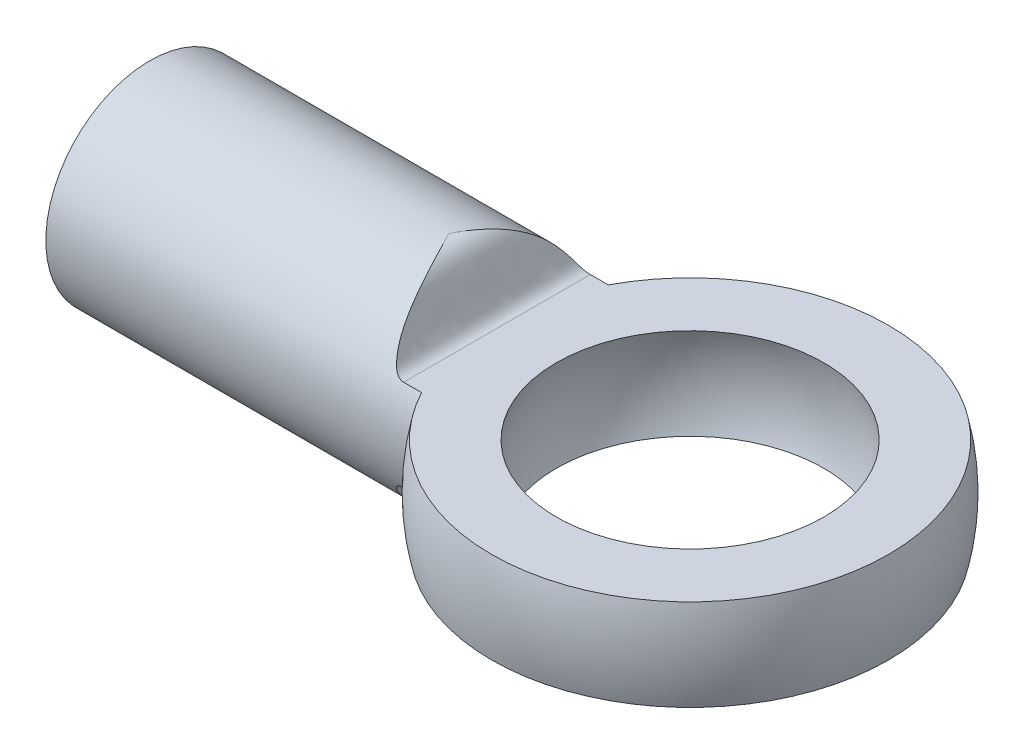
from build123d import *

# Parameters (mm, degrees)
CUT_EXTRUDE1_REACH                  = 16.116
CUT_EXTRUDE1_END_RADIUS             = 2.5
CUT_EXTRUDE1_DIRECTION_2_REACH      = 16.116
CUT_EXTRUDE1_DIRECTION_2_END_RADIUS = 2.5


with BuildPart() as part:
    # Sketch2 → Revolve1 (revolve)
    with BuildSketch(Plane.XY):
        with BuildLine():
            Line((3.217141588, 1.1), (4.774934555, 1.1))
            ThreePointArc((4.774934555, 1.1), (4.9, 0), (4.774934555, -1.1))
            Line((4.774934555, -1.1), (3.217141588, -1.1))
            ThreePointArc((3.217141588, -1.1), (3.4, 0), (3.217141588, 1.1))
        make_face()
    revolve(axis=Axis((0, 4.071851736, 0), (0, -1, 0)))

    # Sketch3 → Revolve2 (revolve)
    with BuildSketch(Plane(origin=(0, 0, 0), x_dir=(1, 0, 0), z_dir=(0, 1, 0))):
        with BuildLine():
            Line((-13, 1.5), (-5.974934555, 1.5))
            Line((-5.974934555, 1.5), (-5.974934555, 0))
            Line((-5.974934555, 0), (-4.774934555, 0))
            ThreePointArc((-4.774934555, 0), (-4.594847185, 1.298991664), (-4.068169121, 2.5))
            Line((-4.068169121, 2.5), (-13, 2.5))
            Line((-13, 2.5), (-13, 1.5))
        make_face()
    revolve(axis=Axis((-1.070003769, 0, 0), (-1, 0, 0)))

    # Cut-Extrude1: up to this cylinder (the profile starts inside it)
    cut_extrude1_end = Plane(origin=(-4.461396, 0, 0), z_dir=(1, 0, 0)) * Cylinder(CUT_EXTRUDE1_END_RADIUS, 38.232024, mode=Mode.PRIVATE)
    # Sketch5 → Cut-Extrude1 (cut, up to the surface)
    with BuildSketch(Plane.XY, mode=Mode.PRIVATE) as cut_extrude1_sk1:
        with BuildLine():
            Line((-5.802324208, 2.5), (-3.740894424, 2.5))
            Line((-3.740894424, 2.5), (-3.740894424, 1.1))
            Line((-3.740894424, 1.1), (-4.646504062, 1.1))
            add(Edge.make_bspline(
                [(-4.646504062, 1.1), (-4.808494897, 1.1), (-5.037328654, 1.452538147), (-5.179468889, 2.019128522), (-5.472528246, 2.5), (-5.802324208, 2.5)],
                knots=[0, 0, 0, 0, 0.209972055, 0.594973977, 1, 1, 1, 1], degree=3))
        make_face()
    cut_extrude1_tool1 = extrude(cut_extrude1_sk1.sketch, amount=-CUT_EXTRUDE1_REACH, mode=Mode.PRIVATE) & cut_extrude1_end
    add(cut_extrude1_tool1.solids().sort_by_distance((-4.461384, 1.858771, 0))[0], mode=Mode.SUBTRACT)
    # Sketch5 → Cut-Extrude1 (cut, up to the surface)
    with BuildSketch(Plane.XY, mode=Mode.PRIVATE) as cut_extrude1_sk2:
        with BuildLine():
            Line((-3.740894424, -1.1), (-4.646504062, -1.1))
            add(Edge.make_bspline(
                [(-4.646504062, -1.1), (-4.808494897, -1.1), (-5.037328654, -1.452538147), (-5.179468889, -2.019128522), (-5.472528246, -2.5), (-5.802324208, -2.5)],
                knots=[0, 0, 0, 0, 0.209972055, 0.594973977, 1, 1, 1, 1], degree=3))
            Line((-5.802324208, -2.5), (-3.740894424, -2.5))
            Line((-3.740894424, -2.5), (-3.740894424, -1.1))
        make_face()
    cut_extrude1_tool2 = extrude(cut_extrude1_sk2.sketch, amount=-CUT_EXTRUDE1_REACH, mode=Mode.PRIVATE) & cut_extrude1_end
    add(cut_extrude1_tool2.solids().sort_by_distance((-4.461408, -1.858734, 0))[0], mode=Mode.SUBTRACT)

    # Cut-Extrude1 direction 2: up to this cylinder (the profile starts inside it)
    cut_extrude1_direction_2_end = Plane(origin=(-4.461396, 0, 0), z_dir=(1, 0, 0)) * Cylinder(CUT_EXTRUDE1_DIRECTION_2_END_RADIUS, 38.232024, mode=Mode.PRIVATE)
    # Sketch5 → Cut-Extrude1 direction 2 (cut, up to the surface)
    with BuildSketch(Plane.XY, mode=Mode.PRIVATE) as cut_extrude1_direction_2_sk1:
        with BuildLine():
            Line((-5.802324208, 2.5), (-3.740894424, 2.5))
            Line((-3.740894424, 2.5), (-3.740894424, 1.1))
            Line((-3.740894424, 1.1), (-4.646504062, 1.1))
            add(Edge.make_bspline(
                [(-4.646504062, 1.1), (-4.808494897, 1.1), (-5.037328654, 1.452538147), (-5.179468889, 2.019128522), (-5.472528246, 2.5), (-5.802324208, 2.5)],
                knots=[0, 0, 0, 0, 0.209972055, 0.594973977, 1, 1, 1, 1], degree=3))
        make_face()
    cut_extrude1_direction_2_tool1 = extrude(cut_extrude1_direction_2_sk1.sketch, amount=CUT_EXTRUDE1_DIRECTION_2_REACH, mode=Mode.PRIVATE) & cut_extrude1_direction_2_end
    add(cut_extrude1_direction_2_tool1.solids().sort_by_distance((-4.461384, 1.858771, 0))[0], mode=Mode.SUBTRACT)
    # Sketch5 → Cut-Extrude1 direction 2 (cut, up to the surface)
    with BuildSketch(Plane.XY, mode=Mode.PRIVATE) as cut_extrude1_direction_2_sk2:
        with BuildLine():
            Line((-3.740894424, -1.1), (-4.646504062, -1.1))
            add(Edge.make_bspline(
                [(-4.646504062, -1.1), (-4.808494897, -1.1), (-5.037328654, -1.452538147), (-5.179468889, -2.019128522), (-5.472528246, -2.5), (-5.802324208, -2.5)],
                knots=[0, 0, 0, 0, 0.209972055, 0.594973977, 1, 1, 1, 1], degree=3))
            Line((-5.802324208, -2.5), (-3.740894424, -2.5))
            Line((-3.740894424, -2.5), (-3.740894424, -1.1))
        make_face()
    cut_extrude1_direction_2_tool2 = extrude(cut_extrude1_direction_2_sk2.sketch, amount=CUT_EXTRUDE1_DIRECTION_2_REACH, mode=Mode.PRIVATE) & cut_extrude1_direction_2_end
    add(cut_extrude1_direction_2_tool2.solids().sort_by_distance((-4.461408, -1.858734, 0))[0], mode=Mode.SUBTRACT)


solid = part.part
